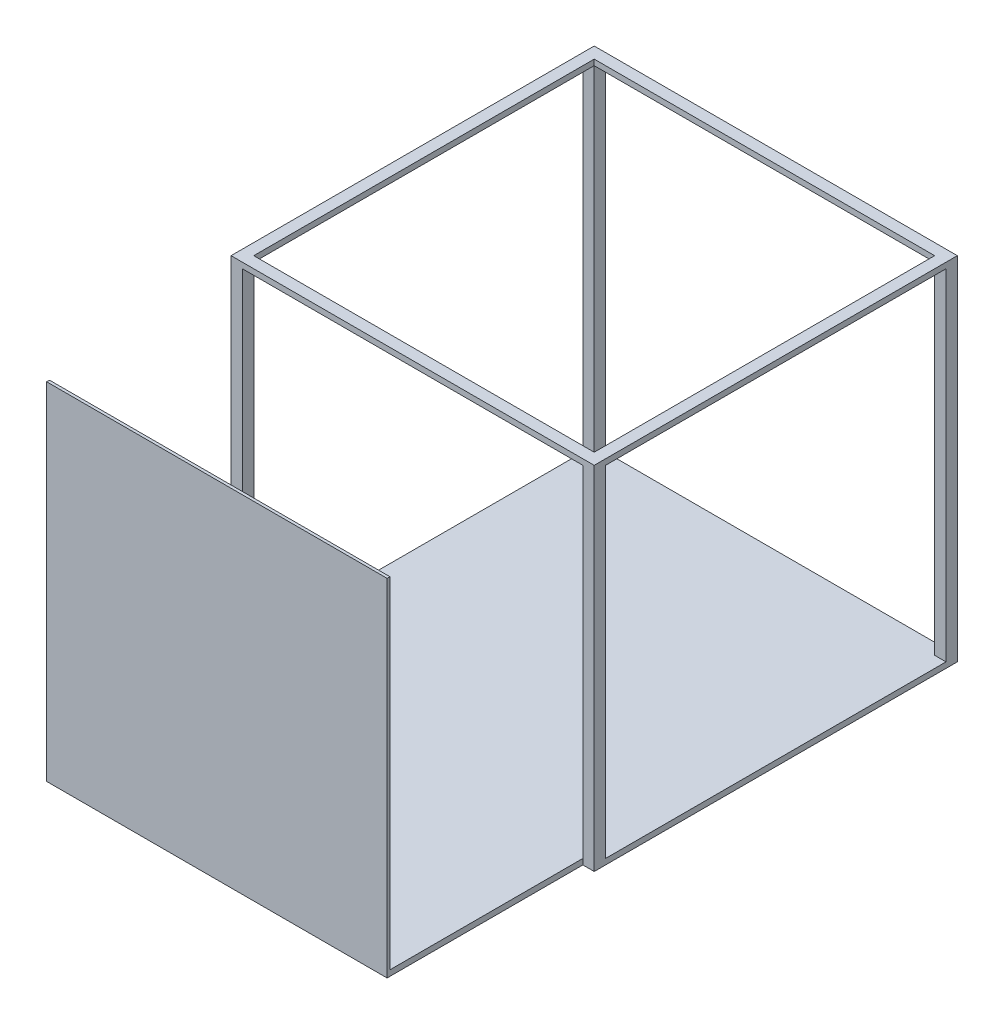
from build123d import *

# Parameters (mm, degrees)
SKETCH1_W           = 406.4
SKETCH1_H           = 406.4
BOSS_EXTRUDE1_DEPTH = 6.35
SKETCH2_W           = 12.7
SKETCH2_H           = 12.7
BOSS_EXTRUDE2_DEPTH = 381
SKETCH3_W           = 406.4
SKETCH3_H           = 406.4
SKETCH3_W_2         = 381
SKETCH3_H_2         = 381
BOSS_EXTRUDE3_DEPTH = 6.35
SKETCH4_W           = 381
SKETCH4_H           = 228.6
BOSS_EXTRUDE4_DEPTH = 6.35
SKETCH6_W           = 381
SKETCH6_H           = 387.35
BOSS_EXTRUDE6_DEPTH = 3.175


with BuildPart() as part:
    # Sketch1 → Boss-Extrude1 (new body)
    with BuildSketch(Plane(origin=(0, 0, 0), x_dir=(1, 0, 0), z_dir=(0, 1, 0))):
        Rectangle(SKETCH1_W, SKETCH1_H)
    extrude(amount=BOSS_EXTRUDE1_DEPTH)

    # Sketch2 → Boss-Extrude2 (add)
    with BuildSketch(Plane(origin=(0, 6.35, 0), x_dir=(1, 0, 0), z_dir=(0, 1, 0))):
        with Locations((-196.85, 196.85)):
            Rectangle(SKETCH2_W, SKETCH2_H)
        with Locations((196.85, 196.85)):
            Rectangle(SKETCH2_W, SKETCH2_H)
        with Locations((196.85, -196.85)):
            Rectangle(SKETCH2_W, SKETCH2_H)
        with Locations((-196.85, -196.85)):
            Rectangle(SKETCH2_W, SKETCH2_H)
    extrude(amount=BOSS_EXTRUDE2_DEPTH)

    # Sketch3 → Boss-Extrude3 (add)
    with BuildSketch(Plane(origin=(0, 387.35, 0), x_dir=(1, 0, 0), z_dir=(0, 1, 0))):
        Rectangle(SKETCH3_W, SKETCH3_H)
        Rectangle(SKETCH3_W_2, SKETCH3_H_2, mode=Mode.SUBTRACT)
    extrude(amount=BOSS_EXTRUDE3_DEPTH)

    # Sketch4 → Boss-Extrude4 (add)
    with BuildSketch(Plane(origin=(0, 6.35, 0), x_dir=(1, 0, 0), z_dir=(0, 1, 0))):
        with Locations((0, -304.8)):
            Rectangle(SKETCH4_W, SKETCH4_H)
    extrude(amount=-BOSS_EXTRUDE4_DEPTH)

    # Sketch6 → Boss-Extrude6 (add)
    with BuildSketch(Plane.XY.offset(419.1)):
        with Locations((0, 193.675)):
            Rectangle(SKETCH6_W, SKETCH6_H)
    extrude(amount=BOSS_EXTRUDE6_DEPTH)


solid = part.part
